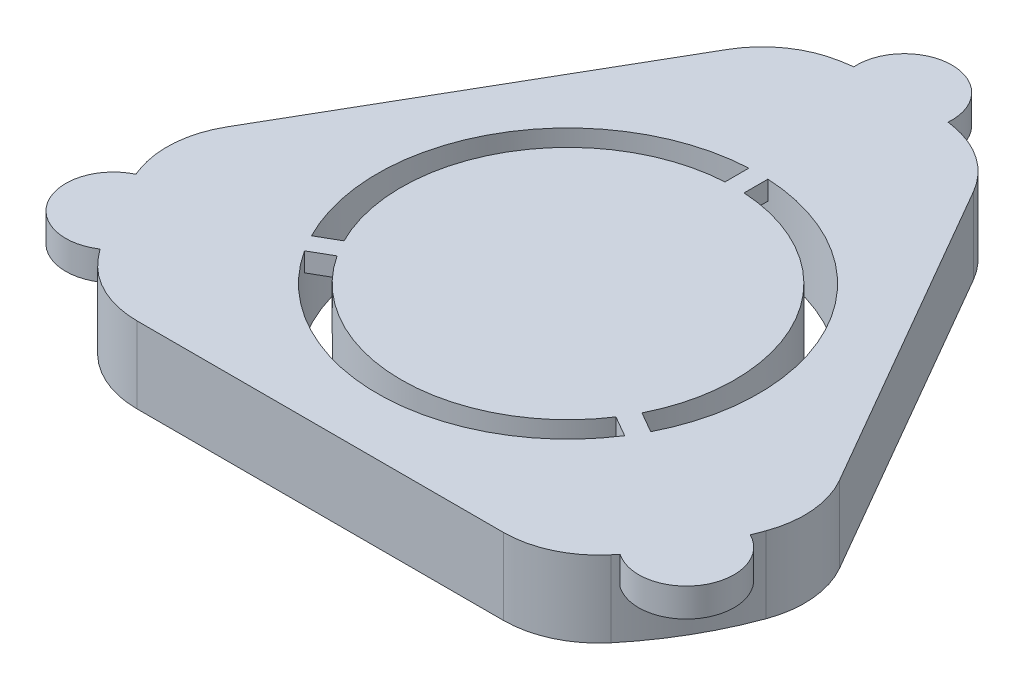
from build123d import *

# Parameters (mm, degrees)
SKETCH1_R                = 20
BOSS_EXTRUDE1_DEPTH      = 3.5
SKETCH2_R                = 35
SKETCH2_R_2              = 20
SKETCH2_R_3              = 2.8
BOSS_EXTRUDE2_DEPTH      = 8
BOSS_EXTRUDE3_DEPTH      = 2
BOSS_EXTRUDE3_DEPTH_BACK = 8
SKETCH4_R                = 2.9
SKETCH5_R                = 5
BOSS_EXTRUDE4_DEPTH      = 3
CUT_EXTRUDE1_START       = -10
SKETCH3_R                = 20
CUT_EXTRUDE1_DEPTH       = 10
SKETCH9_R                = 17.5
BOSS_EXTRUDE5_DEPTH      = 3.5
SKETCH10_R               = 17.5
SKETCH10_R_2             = 16.5
BOSS_EXTRUDE6_DEPTH      = 4.5
SKETCH11_W               = 2
SKETCH11_H               = 6.599117057
BOSS_EXTRUDE7_DEPTH      = 2
SKETCH12_R               = 72.135852014
CUT_EXTRUDE2_DEPTH       = 22
FILLET1_R                = 10


with BuildPart() as part:
    # Sketch1 → Boss-Extrude1 (new body)
    with BuildSketch(Plane(origin=(0, 0, 0), x_dir=(1, 0, 0), z_dir=(0, 1, 0))):
        with Locations(Location((0, 0, 0), (0, 0, 270))):
            Circle(SKETCH1_R)
    extrude(amount=BOSS_EXTRUDE1_DEPTH)

    # Sketch2 → Boss-Extrude2 (add)
    with BuildSketch(Plane(origin=(0, 0, 0), x_dir=(1, 0, 0), z_dir=(0, 1, 0))):
        with Locations(Location((0, 0, 0), (0, 0, 270))):
            Circle(SKETCH2_R)
        with Locations(Location((0, 0, 0), (0, 0, 270))):
            Circle(SKETCH2_R_2, mode=Mode.SUBTRACT)
        with Locations(Location((0, 29, 0), (0, 0, 270))):
            Circle(SKETCH2_R_3, mode=Mode.SUBTRACT)
        with Locations(Location((25.11473671, -14.5, 0), (0, 0, 270))):
            Circle(SKETCH2_R_3, mode=Mode.SUBTRACT)
        with Locations(Location((-25.11473671, -14.5, 0), (0, 0, 270))):
            Circle(SKETCH2_R_3, mode=Mode.SUBTRACT)
    extrude(amount=BOSS_EXTRUDE2_DEPTH)

    # Sketch4 → Boss-Extrude3 (add, two sides: drawn at the far end of the back side and taken through both)
    with BuildSketch(Plane.XZ.offset(-BOSS_EXTRUDE3_DEPTH_BACK)):
        with Locations(Location((-25.11473671, 14.5, 0), (0, 0, 270))):
            Circle(SKETCH4_R)
        with Locations(Location((25.11473671, 14.5, 0), (0, 0, 270))):
            Circle(SKETCH4_R)
        with Locations(Location((0, -29, 0), (0, 0, 270))):
            Circle(SKETCH4_R)
    extrude(amount=BOSS_EXTRUDE3_DEPTH + BOSS_EXTRUDE3_DEPTH_BACK)

    # Sketch5 → Boss-Extrude4 (add)
    with BuildSketch(Plane(origin=(0, 8, 0), x_dir=(1, 0, 0), z_dir=(0, 1, 0))):
        with Locations((-30.453629482, -17.250404383)):
            Circle(SKETCH5_R)
        with Locations((0.28752632, 34.99881896)):
            Circle(SKETCH5_R)
        with Locations((30.166103162, -17.748414577)):
            Circle(SKETCH5_R)
    extrude(amount=-BOSS_EXTRUDE4_DEPTH)

    # Sketch3 → Cut-Extrude1 (cut)
    with BuildSketch(Plane(origin=(0, 3.5, 0), x_dir=(1, 0, 0), z_dir=(0, 1, 0)).offset(CUT_EXTRUDE1_START)):
        with Locations(Location((0, 0, 0), (0, 0, 270))):
            Circle(SKETCH3_R)
    extrude(amount=CUT_EXTRUDE1_DEPTH, mode=Mode.SUBTRACT)



with BuildPart() as body_2:
    # Sketch9 → Boss-Extrude5 (new body)
    with BuildSketch(Plane(origin=(0, 8, 0), x_dir=(1, 0, 0), z_dir=(0, 1, 0))):
        with Locations(Location((0, 0, 0), (0, 0, 270))):
            Circle(SKETCH9_R)
    extrude(amount=-BOSS_EXTRUDE5_DEPTH)

    # Sketch10 → Boss-Extrude6 (add)
    with BuildSketch(Plane(origin=(0, 4.5, 0), x_dir=(-1, 0, 0), z_dir=(0, -1, 0))):
        with Locations(Location((0, 0, 0), (0, 0, 270))):
            Circle(SKETCH10_R)
        with Locations(Location((0, 0, 0), (0, 0, 270))):
            Circle(SKETCH10_R_2, mode=Mode.SUBTRACT)
    extrude(amount=BOSS_EXTRUDE6_DEPTH)


with BuildPart() as part_1:
    add(part.part)

    add(body_2.part)  # Boss-Extrude7 merges body 2
    # Sketch11 → Boss-Extrude7 (add)
    with BuildSketch(Plane(origin=(0, 8, 0), x_dir=(1, 0, 0), z_dir=(0, 1, 0))):
        Polygon((19.946286756, -10.36129349), (14.231283742, -7.061734961), (13.231283742, -8.793785769), (18.946286756, -12.093344297), align=None)
        with Locations((0, 19.155079259)):
            Rectangle(SKETCH11_W, SKETCH11_H)
        Polygon((-18.946286756, -12.093344297), (-13.231283742, -8.793785769), (-14.231283742, -7.061734961), (-19.946286756, -10.36129349), align=None)
    extrude(amount=-BOSS_EXTRUDE7_DEPTH)

    # Sketch12 → Cut-Extrude2 (cut)
    with BuildSketch(Plane(origin=(0, 8, 0), x_dir=(1, 0, 0), z_dir=(0, 1, 0))):
        Circle(SKETCH12_R)
        Polygon((0, 52), (-45.033320997, -26), (45.033320997, -26), align=None, mode=Mode.SUBTRACT)
    extrude(amount=-CUT_EXTRUDE2_DEPTH, mode=Mode.SUBTRACT)

    # Fillet1
    fillet1_edges = [part_1.edges().sort_by_distance(p)[0] for p in [
        (34.232035012, 4, 7.291623888),
        (10.801285985, 4, -33.291623888),
        (-23.430749028, 4, 26),
        (23.430749028, 4, 26),
        (-10.801285985, 4, -33.291623888),
        (-34.232035012, 4, 7.291623888),
    ]]
    fillet(fillet1_edges, radius=FILLET1_R)


solid = part_1.part
